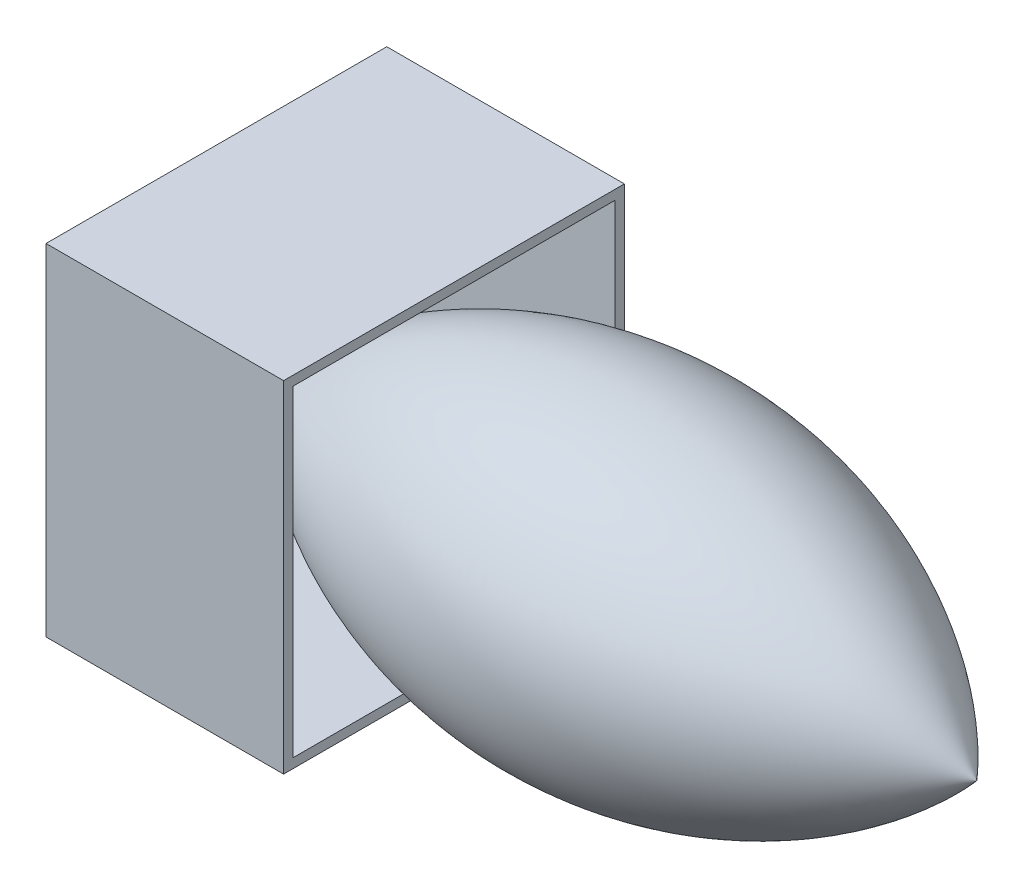
from build123d import *

# Parameters (mm, degrees)
BOSS_EXTRUDE1_DEPTH      = 0.4
BOSS_EXTRUDE1_DEPTH_BACK = 0.1
SKETCH2_W                = 0.717124344
SKETCH2_H                = 0.717124344
SKETCH2_W_2              = 0.677124344
SKETCH2_H_2              = 0.677124344


with BuildPart() as part:
    # Sketch1 → Revolve1 (revolve)
    with BuildSketch(Plane.XY):
        with BuildLine():
            Line((1.5, 0), (0, 0))
            ThreePointArc((0, 0), (0.75, 0.338562172), (1.5, 0))
        make_face()
    revolve(axis=Axis((0, 0, 0), (1, 0, 0)))


with BuildPart() as body_2:
    # Sketch2 → Boss-Extrude1 (new, two sides: drawn at the far end of the back side and taken through both)
    with BuildSketch(Plane(origin=(0, 0, 0), x_dir=(0, 0, -1), z_dir=(1, 0, 0)).offset(-BOSS_EXTRUDE1_DEPTH_BACK)):
        Rectangle(SKETCH2_W, SKETCH2_H)
        Rectangle(SKETCH2_W_2, SKETCH2_H_2, mode=Mode.SUBTRACT)
    extrude(amount=BOSS_EXTRUDE1_DEPTH + BOSS_EXTRUDE1_DEPTH_BACK)


solid = Compound([part.part, body_2.part])
